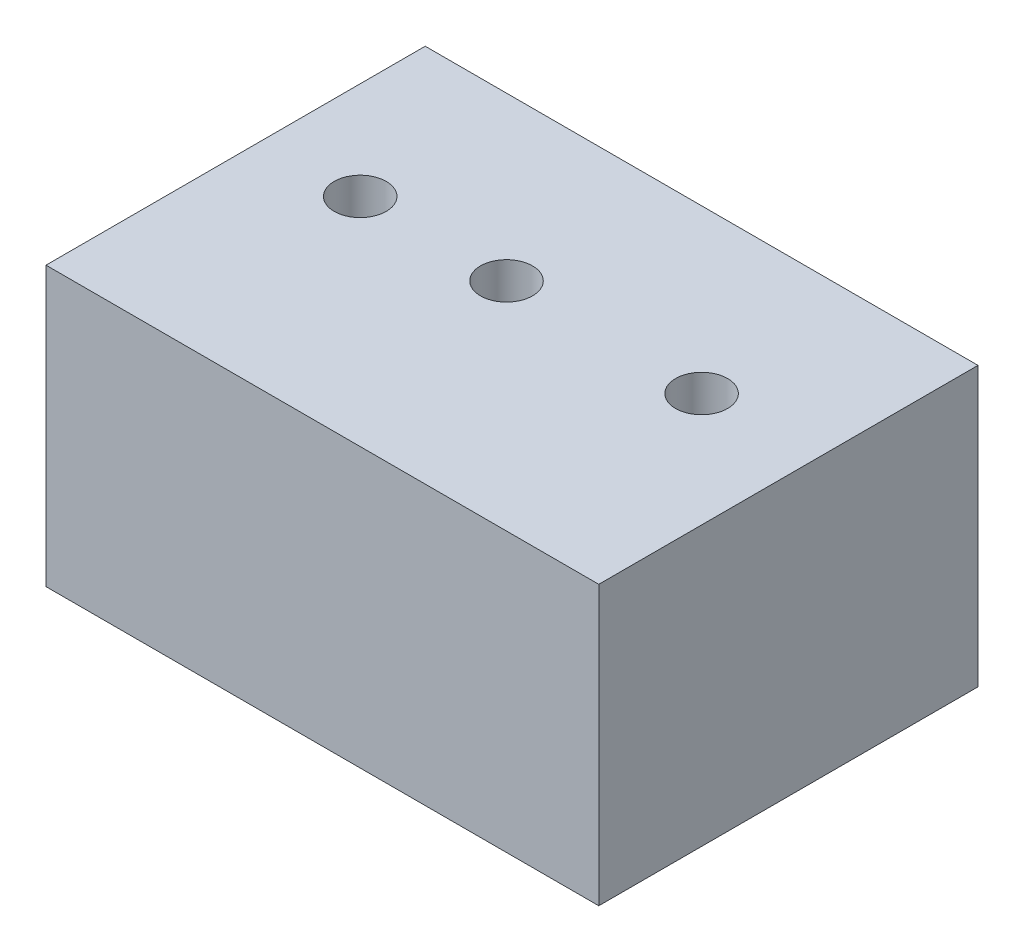
from build123d import *

# Parameters (mm, degrees)
SKETCH1_W           = 34
SKETCH1_H           = 23.325
SKETCH1_R           = 1.6
BOSS_EXTRUDE1_DEPTH = 17.125


with BuildPart() as part:
    # Sketch1 → Boss-Extrude1 (new body)
    with BuildSketch(Plane(origin=(0, 0, 0), x_dir=(1, 0, 0), z_dir=(0, 1, 0))):
        with Locations((17, 11.6625)):
            Rectangle(SKETCH1_W, SKETCH1_H)
        with Locations(Location((6, 13.325, 0), (0, 0, 270))):
            Circle(SKETCH1_R, mode=Mode.SUBTRACT)
        with Locations(Location((15, 13.325, 0), (0, 0, 270))):
            Circle(SKETCH1_R, mode=Mode.SUBTRACT)
        with Locations(Location((27, 13.325, 0), (0, 0, 270))):
            Circle(SKETCH1_R, mode=Mode.SUBTRACT)
    extrude(amount=BOSS_EXTRUDE1_DEPTH)


solid = part.part
